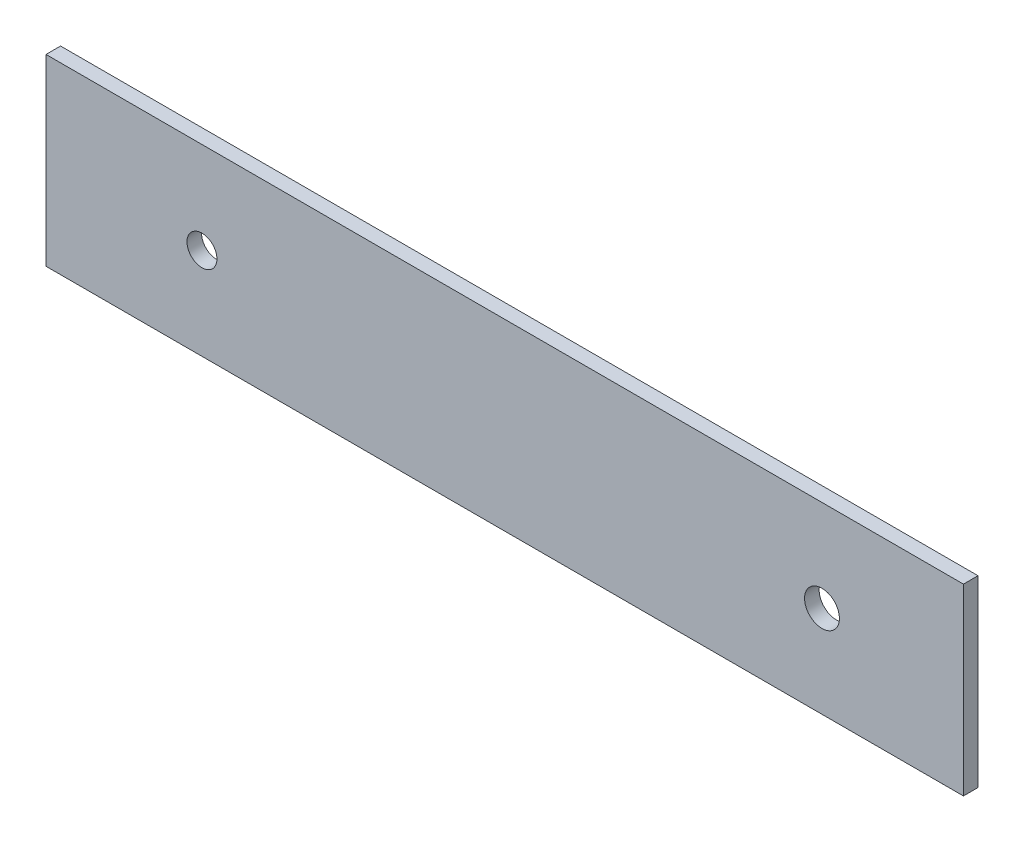
from build123d import *

# Parameters (mm, degrees)
SKETCH1_W             = 100
SKETCH1_H             = 20
BOSS_EXTRUDE1_DEPTH   = 1.5875
F_4_CLEARANCE_HOLE1_D = 3.2639
F_6_CLEARANCE_HOLE1_D = 3.7973


with BuildPart() as part:
    # Sketch1 → Boss-Extrude1 (new body)
    with BuildSketch(Plane.XY):
        with Locations((0, 10)):
            Rectangle(SKETCH1_W, SKETCH1_H)
    extrude(amount=BOSS_EXTRUDE1_DEPTH)

    # #4 Clearance Hole1 (through all)
    with Locations(Plane.XY.offset(1.5875)):
        with Locations((-33, 10)):
            Hole(F_4_CLEARANCE_HOLE1_D / 2)

    # #6 Clearance Hole1 (through all)
    with Locations(Plane.XY.offset(1.5875)):
        with Locations((34.58, 10)):
            Hole(F_6_CLEARANCE_HOLE1_D / 2)


solid = part.part
